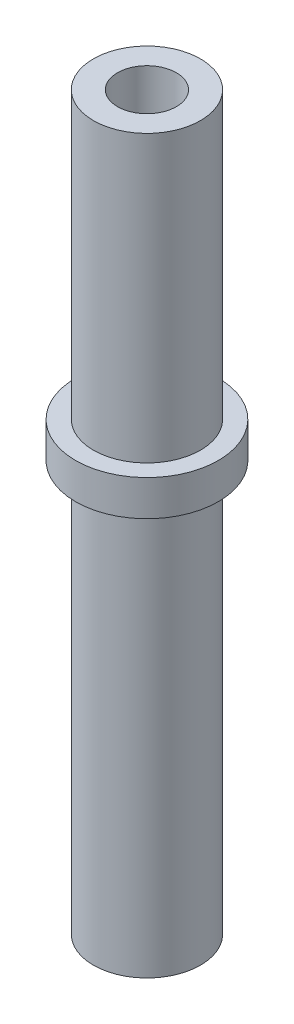
from build123d import *

# Parameters (mm, degrees)
BOSS_EXTRUDE1_DEPTH      = 20.5
BOSS_EXTRUDE1_DEPTH_BACK = 20.5
SKETCH1_R                = 3
SKETCH6_R                = 4
BOSS_EXTRUDE2_DEPTH      = 2


with BuildPart() as part:
    # Sketch1 → Boss-Extrude1 (new, two sides: drawn at the far end of the back side and taken through both)
    with BuildSketch(Plane(origin=(0, 0, 0), x_dir=(1, 0, 0), z_dir=(0, 1, 0)).offset(-BOSS_EXTRUDE1_DEPTH_BACK)):
        Circle(SKETCH1_R)
    extrude(amount=BOSS_EXTRUDE1_DEPTH + BOSS_EXTRUDE1_DEPTH_BACK)

    # Sketch5 → M4x0.7 Tapped Hole1 (revolve, cut)
    with BuildSketch(Plane(origin=(0, 20.5, 0), x_dir=(0, 0, 1), z_dir=(1, 0, 0))):
        Polygon((0, 0), (0, 8.991420021), (1.65, 8), (1.65, 0), align=None)
    m4x0_7_tapped_hole1 = revolve(axis=Axis((0, 26.85, 0), (0, -1, 0)), mode=Mode.SUBTRACT)

    # Sketch6 → Boss-Extrude2 (add)
    with BuildSketch(Plane(origin=(0, 2.5, 0), x_dir=(1, 0, 0), z_dir=(0, 1, 0))):
        Circle(SKETCH6_R)
    extrude(amount=BOSS_EXTRUDE2_DEPTH)

    # Mirror1: M4x0.7 Tapped Hole1 across plane
    add(m4x0_7_tapped_hole1.mirror(Plane.ZX), mode=Mode.SUBTRACT)


solid = part.part
